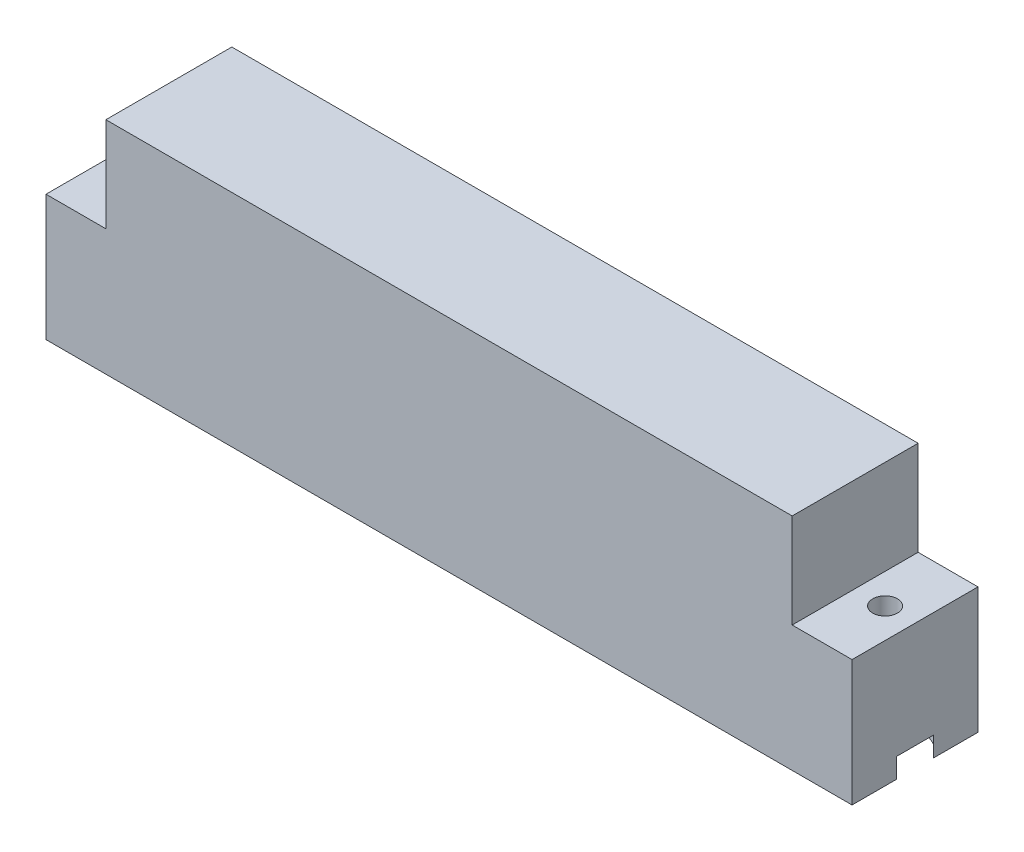
from build123d import *

# Parameters (mm, degrees)
SKETCH1_W           = 81.28
SKETCH1_H           = 12.7
BOSS_EXTRUDE1_DEPTH = 12.7
SKETCH2_W           = 69.20484
SKETCH2_H           = 12.7
BOSS_EXTRUDE2_DEPTH = 9.525
SKETCH3_R           = 1.25
CUT_EXTRUDE2_DEPTH  = 84.24072561
SKETCH5_R           = 3.556
CUT_EXTRUDE3_DEPTH  = 1.99898
SKETCH6_R           = 2.19964
CUT_EXTRUDE4_DEPTH  = 1.27
SKETCH7_R           = 1.650000002
CUT_EXTRUDE5_DEPTH  = 6.604


with BuildPart() as part:
    # Sketch1 → Boss-Extrude1 (new body)
    with BuildSketch(Plane(origin=(0, 0, 0), x_dir=(1, 0, 0), z_dir=(0, 1, 0))):
        with Locations((40.64, 6.35)):
            Rectangle(SKETCH1_W, SKETCH1_H)
    extrude(amount=BOSS_EXTRUDE1_DEPTH)

    # Sketch2 → Boss-Extrude2 (add)
    with BuildSketch(Plane(origin=(0, 12.7, 0), x_dir=(1, 0, 0), z_dir=(0, 1, 0))):
        with Locations((40.64, 6.35)):
            Rectangle(SKETCH2_W, SKETCH2_H)
    extrude(amount=BOSS_EXTRUDE2_DEPTH)

    # Sketch3 → Cut-Extrude2 (cut, through all)
    with BuildSketch(Plane(origin=(0, 12.7, 0), x_dir=(1, 0, 0), z_dir=(0, 1, 0))):
        with Locations(Location((3.01879, 6.35, 0), (0, 0, 270))):
            Circle(SKETCH3_R)
        with Locations(Location((78.26121, 6.35, 0), (0, 0, 270))):
            Circle(SKETCH3_R)
    extrude(amount=-CUT_EXTRUDE2_DEPTH, mode=Mode.SUBTRACT)

    # Sketch5 → Cut-Extrude3 (cut)
    with BuildSketch(Plane.XZ):
        with Locations((3.01879, -6.35)):
            Circle(SKETCH5_R)
        with Locations((78.26121, -6.35)):
            Circle(SKETCH5_R)
    extrude(amount=-CUT_EXTRUDE3_DEPTH, mode=Mode.SUBTRACT)

    # Sketch6 → Cut-Extrude4 (cut)
    with BuildSketch(Plane(origin=(0, 0, -12.7), x_dir=(-1, 0, 0), z_dir=(0, 0, -1))):
        with Locations((-40.64, 13.29944)):
            Circle(SKETCH6_R)
    extrude(amount=-CUT_EXTRUDE4_DEPTH, mode=Mode.SUBTRACT)

    # Sketch7 → Cut-Extrude5 (cut)
    with BuildSketch(Plane(origin=(0, 0, -11.43), x_dir=(-1, 0, 0), z_dir=(0, 0, -1))):
        with Locations((-40.64, 13.29944)):
            Circle(SKETCH7_R)
    extrude(amount=-CUT_EXTRUDE5_DEPTH, mode=Mode.SUBTRACT)


solid = part.part
